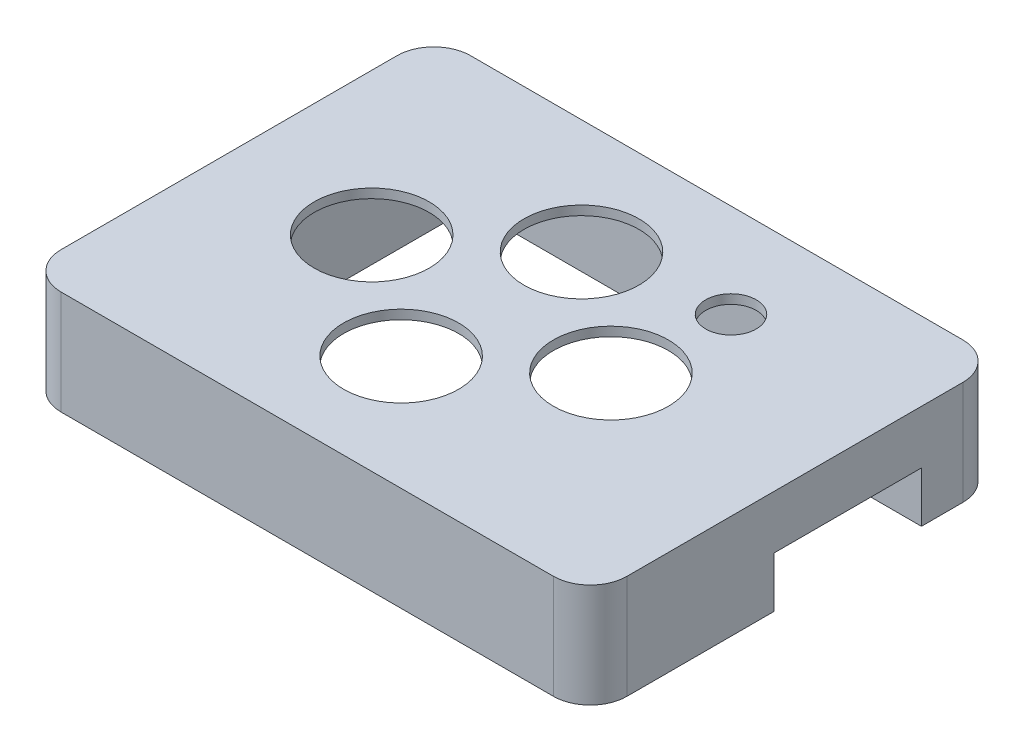
from build123d import *

# Parameters (mm, degrees)
SKETCH1_W           = 47.5
SKETCH1_H           = 38.5
SKETCH1_R           = 6.25
SKETCH1_R_2         = 2.75
BOSS_EXTRUDE2_DEPTH = 1
SKETCH2_W           = 61.5
SKETCH2_H           = 44.5
SKETCH2_R           = 1.55
SKETCH2_W_2         = 47.5
SKETCH2_H_2         = 38.5
BOSS_EXTRUDE3_DEPTH = 11.3
SKETCH3_R           = 1.55
BOSS_EXTRUDE4_DEPTH = 2
FILLET2_R           = 4
SKETCH4_W           = 16
SKETCH4_H           = 5.5
CUT_EXTRUDE1_DEPTH  = 8


with BuildPart() as part:
    # Sketch1 → Boss-Extrude2 (new body)
    with BuildSketch(Plane(origin=(0, 0, 0), x_dir=(1, 0, 0), z_dir=(0, 1, 0))):
        Rectangle(SKETCH1_W, SKETCH1_H)
        with Locations(Location((-2.25, 9.8, 0), (0, 0, 270))):
            Circle(SKETCH1_R, mode=Mode.SUBTRACT)
        with Locations(Location((10.75, 0, 0), (0, 0, 270))):
            Circle(SKETCH1_R, mode=Mode.SUBTRACT)
        with Locations(Location((-15.25, 0, 0), (0, 0, 270))):
            Circle(SKETCH1_R, mode=Mode.SUBTRACT)
        with Locations(Location((-2.25, -9.8, 0), (0, 0, 270))):
            Circle(SKETCH1_R, mode=Mode.SUBTRACT)
        with Locations(Location((11.75, 12.05, 0), (0, 0, 270))):
            Circle(SKETCH1_R_2, mode=Mode.SUBTRACT)
    extrude(amount=BOSS_EXTRUDE2_DEPTH)

    # Sketch2 → Boss-Extrude3 (add)
    with BuildSketch(Plane(origin=(0, 1, 0), x_dir=(1, 0, 0), z_dir=(0, 1, 0))):
        Rectangle(SKETCH2_W, SKETCH2_H)
        with Locations(Location((-27.25, 18.75, 0), (0, 0, 270))):
            Circle(SKETCH2_R, mode=Mode.SUBTRACT)
        with Locations(Location((27.25, 18.75, 0), (0, 0, 90))):
            Circle(SKETCH2_R, mode=Mode.SUBTRACT)
        with Locations(Location((27.25, -18.75, 0), (0, 0, 270))):
            Circle(SKETCH2_R, mode=Mode.SUBTRACT)
        with Locations(Location((-27.25, -18.75, 0), (0, 0, 90))):
            Circle(SKETCH2_R, mode=Mode.SUBTRACT)
        Rectangle(SKETCH2_W_2, SKETCH2_H_2, mode=Mode.SUBTRACT)
    extrude(amount=-BOSS_EXTRUDE3_DEPTH)

    # Sketch3 → Boss-Extrude4 (add)
    with BuildSketch(Plane.XZ.offset(-1)):
        with Locations(Location((27.25, -18.75, 0), (0, 0, 270))):
            Circle(SKETCH3_R)
        with Locations(Location((27.25, 18.75, 0), (0, 0, 90))):
            Circle(SKETCH3_R)
        with Locations(Location((-27.25, 18.75, 0), (0, 0, 270))):
            Circle(SKETCH3_R)
        with Locations(Location((-27.25, -18.75, 0), (0, 0, 90))):
            Circle(SKETCH3_R)
    extrude(amount=BOSS_EXTRUDE4_DEPTH)

    # Fillet2
    fillet2_edges = [part.edges().sort_by_distance(p)[0] for p in [
        (-30.75, -4.65, 22.25),
        (-30.75, -4.65, -22.25),
        (30.75, -4.65, -22.25),
        (30.75, -4.65, 22.25),
    ]]
    fillet(fillet2_edges, radius=FILLET2_R)

    # Sketch4 → Cut-Extrude1 (cut)
    with BuildSketch(Plane.ZY.offset(-23.75)):
        with Locations((-5.75, -7.55)):
            Rectangle(SKETCH4_W, SKETCH4_H)
    extrude(amount=-CUT_EXTRUDE1_DEPTH, mode=Mode.SUBTRACT)


solid = part.part
